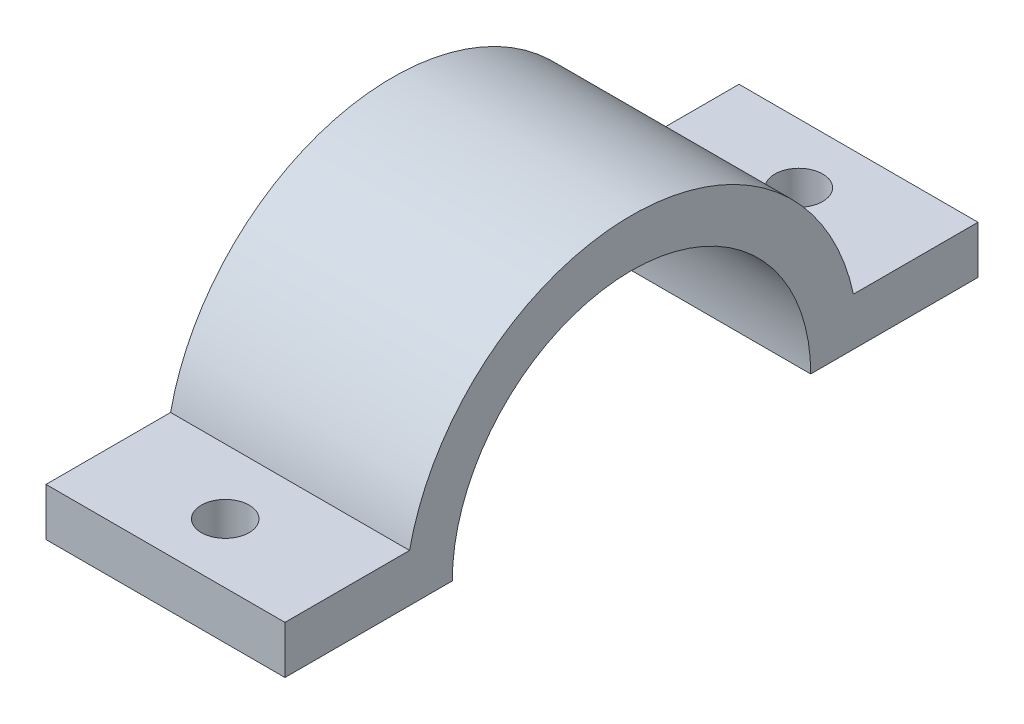
from build123d import *

# Parameters (mm, degrees)
BOSS_EXTRUDE1_DEPTH = 10
SKETCH2_R           = 1
CUT_EXTRUDE1_DEPTH  = 2
SKETCH3_R           = 1
CUT_EXTRUDE5_DEPTH  = 2


with BuildPart() as part:
    # Sketch1 → Boss-Extrude1 (new body)
    with BuildSketch(Plane(origin=(0, 0, 0), x_dir=(0, 0, -1), z_dir=(1, 0, 0))):
        with BuildLine():
            Line((7.5, 0), (14.5, 0))
            Line((14.5, 0), (14.5, 2))
            Line((14.5, 2), (9.287087811, 2))
            ThreePointArc((9.287087811, 2), (0, 9.5), (-9.287087811, 2))
            Line((-9.287087811, 2), (-14.5, 2))
            Line((-14.5, 2), (-14.5, 0))
            Line((-14.5, 0), (-7.5, 0))
            ThreePointArc((-7.5, 0), (0, 7.5), (7.5, 0))
        make_face()
    extrude(amount=BOSS_EXTRUDE1_DEPTH)

    # Sketch2 → Cut-Extrude1 (cut)
    with BuildSketch(Plane(origin=(0, 2, 0), x_dir=(1, 0, 0), z_dir=(0, 1, 0))):
        with Locations(Location((5, 12, 0), (0, 0, 270))):
            Circle(SKETCH2_R)
    extrude(amount=-CUT_EXTRUDE1_DEPTH, mode=Mode.SUBTRACT)

    # Sketch3 → Cut-Extrude5 (cut)
    with BuildSketch(Plane(origin=(0, 0, 0), x_dir=(1, 0, 0), z_dir=(0, 1, 0))):
        with Locations(Location((5, -12, 0), (0, 0, 270))):
            Circle(SKETCH3_R)
    extrude(amount=CUT_EXTRUDE5_DEPTH, mode=Mode.SUBTRACT)


solid = part.part
